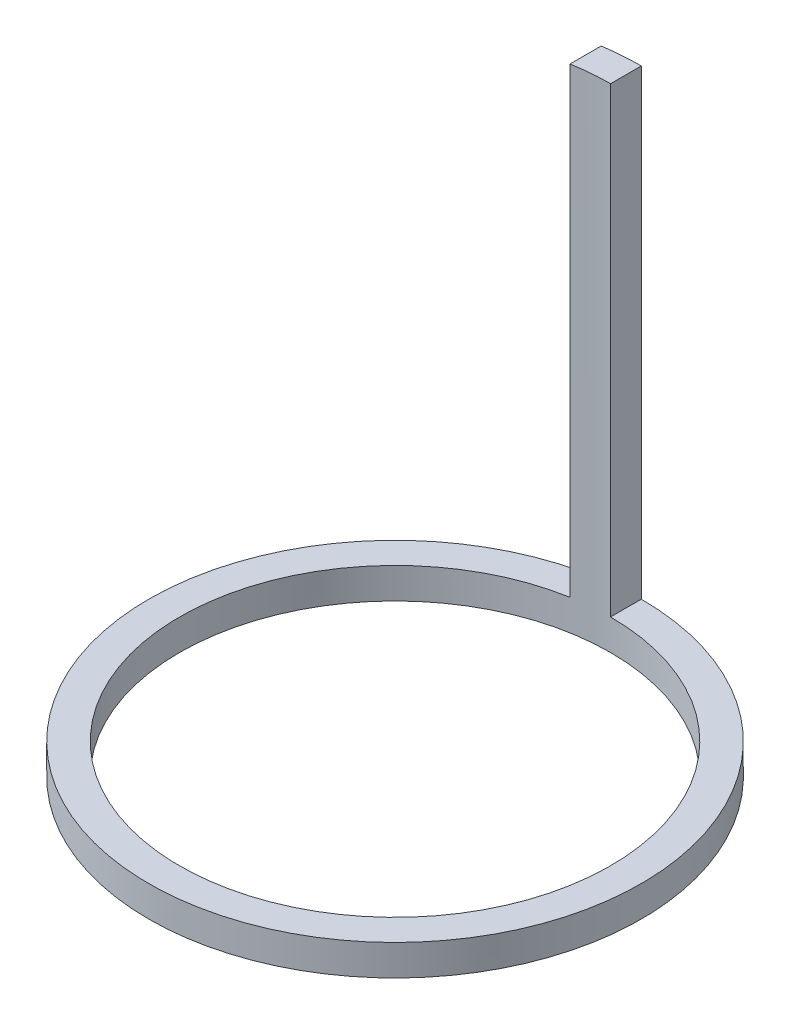
from build123d import *
from build123d.topology import SkipClean

# Parameters (mm, degrees)
SKETCH1_R           = 50.8
SKETCH1_R_2         = 44.45
BOSS_EXTRUDE1_DEPTH = 6.35
BOSS_EXTRUDE2_DEPTH = 95.25


with BuildPart() as part:
    # Sketch1 → Boss-Extrude1 (new body)
    with BuildSketch(Plane(origin=(0, 0, 0), x_dir=(1, 0, 0), z_dir=(0, 1, 0))):
        with Locations(Location((0, 0, 0), (0, 0, 270))):
            Circle(SKETCH1_R)
        with Locations(Location((0, 0, 0), (0, 0, 270))):
            Circle(SKETCH1_R_2, mode=Mode.SUBTRACT)
    extrude(amount=BOSS_EXTRUDE1_DEPTH)

    # Sketch2 → Boss-Extrude2 (add)
    with SkipClean():  # the faces are left unmerged after this step: merging them gives an invalid solid
        with BuildSketch(Plane(origin=(0, 6.35, 0), x_dir=(1, 0, 0), z_dir=(0, 1, 0))):
            with BuildLine():
                ThreePointArc((0, 50.8), (-3.863527606, 50.652869163), (-7.704675524, 50.212328915))
                Line((-7.704675524, 50.212328915), (-7.704675524, 43.777168422))
                ThreePointArc((-7.704675524, 43.777168422), (-3.866999071, 44.281472629), (0, 44.45))
                Line((0, 44.45), (0, 50.8))
            make_face()
        extrude(amount=BOSS_EXTRUDE2_DEPTH)


solid = part.part
